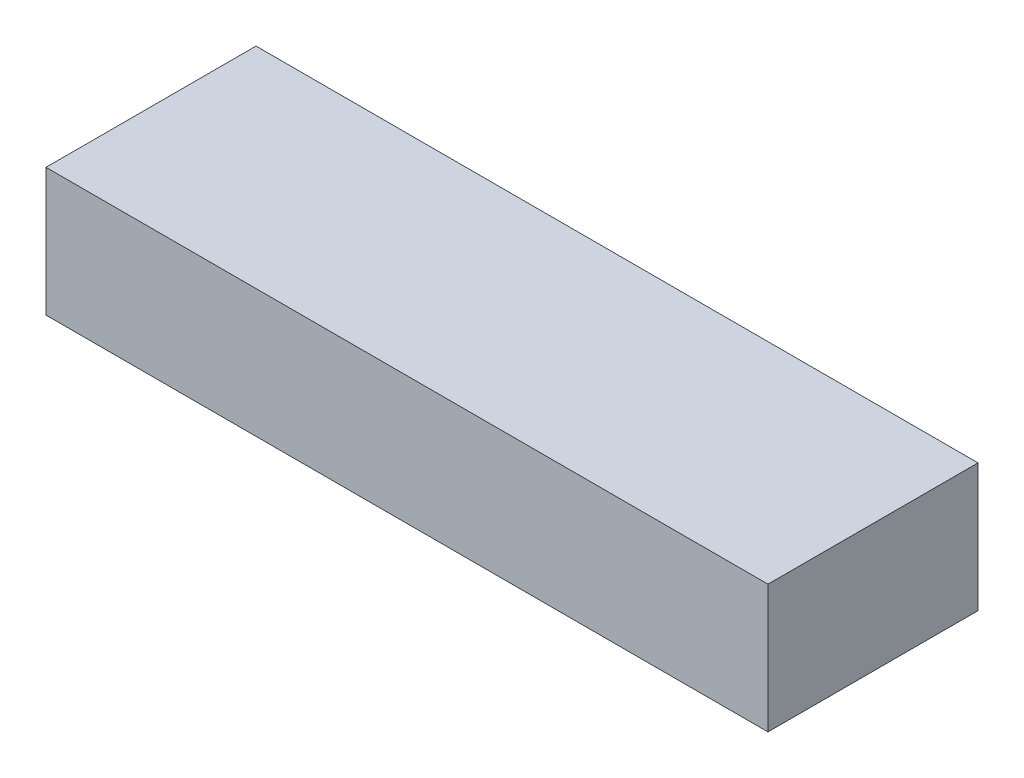
from build123d import *

# Parameters (mm, degrees)
SKETCH1_W           = 22
SKETCH1_H           = 6.4
BOSS_EXTRUDE1_DEPTH = 3.9


with BuildPart() as part:
    # Sketch1 → Boss-Extrude1 (new body)
    with BuildSketch(Plane(origin=(0, 0, 0), x_dir=(1, 0, 0), z_dir=(0, 1, 0))):
        with Locations((11, 3.2)):
            Rectangle(SKETCH1_W, SKETCH1_H)
    extrude(amount=BOSS_EXTRUDE1_DEPTH)


solid = part.part
